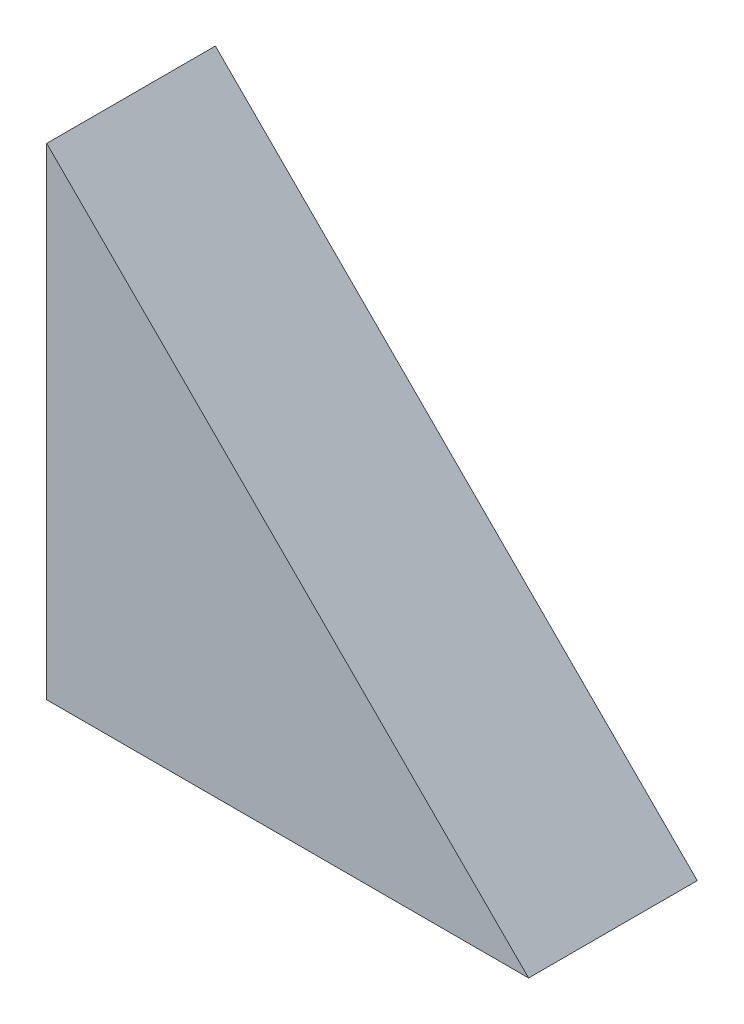
from build123d import *

# Parameters (mm, degrees)
BOSS_EXTRUDE1_DEPTH = 3.5


with BuildPart() as part:
    # Sketch1 → Boss-Extrude1 (new body)
    with BuildSketch(Plane.XY):
        Polygon((0, 0), (0, -10), (10, -10), align=None)
    extrude(amount=BOSS_EXTRUDE1_DEPTH)


solid = part.part
